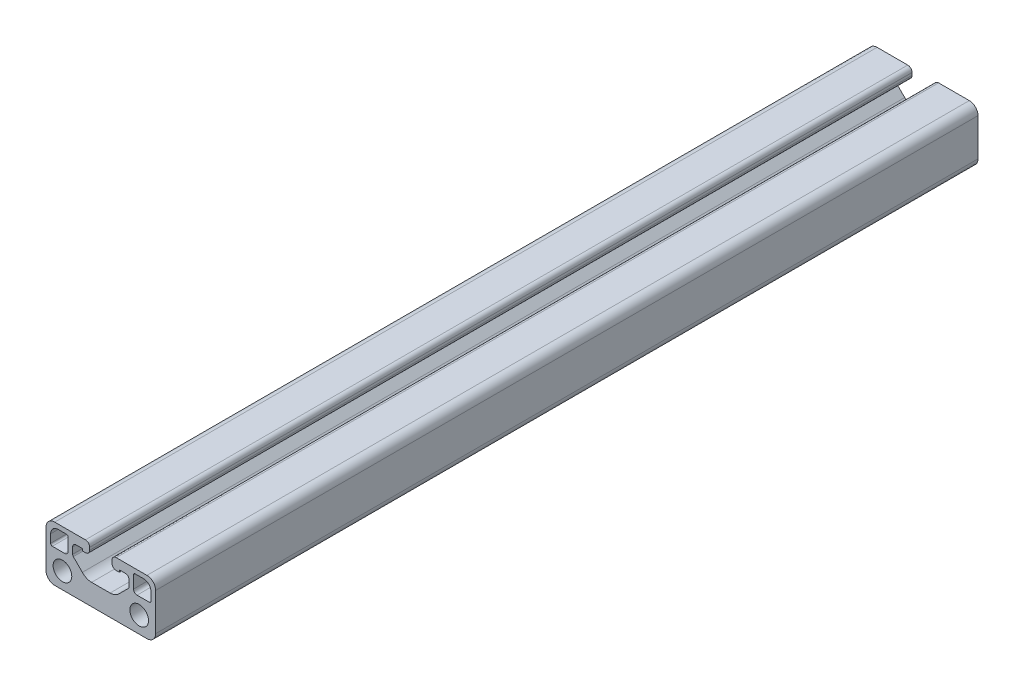
from build123d import *

# Parameters (mm, degrees)
SKETCH1_R      = 3.4036
EXTRUDE1_DEPTH = 300


with BuildPart() as part:
    # Sketch1 → Extrude1 (new body)
    with BuildSketch(Plane.XY):
        with BuildLine():
            Line((-20, 6.825), (-20, -6.825))
            ThreePointArc((-20, -6.825), (-19.07006403, -9.07006403), (-16.825, -10))
            Line((-16.825, -10), (16.825, -10))
            ThreePointArc((16.825, -10), (19.07006403, -9.07006403), (20, -6.825))
            Line((20, -6.825), (20, 6.825))
            ThreePointArc((20, 6.825), (19.07006403, 9.07006403), (16.825, 10))
            Line((16.825, 10), (13.01772333, 10))
            Line((13.01772333, 10), (5.624351215, 10))
            ThreePointArc((5.624351215, 10), (4.518187863, 9.541812137), (4.06, 8.435648785))
            Line((4.06, 8.435648785), (4.06, 7.5148))
            ThreePointArc((4.06, 7.5148), (4.521248241, 6.401248241), (5.6348, 5.94))
            Line((5.6348, 5.94), (6.771827505, 5.94))
            Line((6.771827505, 5.94), (6.771827505, 6.708913257))
            Line((6.771827505, 6.708913257), (9.01577365, 6.708913257))
            ThreePointArc((9.01577365, 6.708913257), (9.929335196, 6.321129388), (10.285, 5.394590897))
            Line((10.285, 5.394590897), (10.285, 3.096216247))
            ThreePointArc((10.285, 3.096216247), (10.241244142, 2.808525014), (10.106931233, 2.550376096))
            Line((10.106931233, 2.550376096), (6.737817619, -0.818737518))
            ThreePointArc((6.737817619, -0.818737518), (5.207385794, -1.896930484), (3.37920183, -2.3))
            Line((3.37920183, -2.3), (-3.37920183, -2.3))
            ThreePointArc((-3.37920183, -2.3), (-5.207385794, -1.896930484), (-6.737817619, -0.818737518))
            Line((-6.737817619, -0.818737518), (-10.024617928, 2.468062791))
            ThreePointArc((-10.024617928, 2.468062791), (-10.217328904, 2.756475149), (-10.285, 3.09668072))
            Line((-10.285, 3.09668072), (-10.285, 5.394590897))
            ThreePointArc((-10.285, 5.394590897), (-9.929335196, 6.321129388), (-9.01577365, 6.708913257))
            Line((-9.01577365, 6.708913257), (-6.771827505, 6.708913257))
            Line((-6.771827505, 6.708913257), (-6.771827505, 5.94))
            Line((-6.771827505, 5.94), (-5.6348, 5.94))
            ThreePointArc((-5.6348, 5.94), (-4.521248241, 6.401248241), (-4.06, 7.5148))
            Line((-4.06, 7.5148), (-4.06, 8.435648785))
            ThreePointArc((-4.06, 8.435648785), (-4.518187863, 9.541812137), (-5.624351215, 10))
            Line((-5.624351215, 10), (-13.017278808, 10))
            Line((-13.017278808, 10), (-16.825, 10))
            ThreePointArc((-16.825, 10), (-19.07006403, 9.07006403), (-20, 6.825))
        make_face()
        with Locations((-14, -4)):
            Circle(SKETCH1_R, mode=Mode.SUBTRACT)
        with Locations((14, -4)):
            Circle(SKETCH1_R, mode=Mode.SUBTRACT)
        with BuildLine():
            Line((-13.212346722, 1.939194793), (-17.688897149, 1.939194793))
            ThreePointArc((-17.688897149, 1.939194793), (-18.133514414, 2.127552649), (-18.31710748, 2.574158493))
            Line((-18.31710748, 2.574158493), (-18.31710748, 5.56561917))
            ThreePointArc((-18.31710748, 5.56561917), (-17.477686114, 7.532412526), (-15.493392654, 8.329584904))
            Line((-15.493392654, 8.329584904), (-12.501931977, 8.329584904))
            ThreePointArc((-12.501931977, 8.329584904), (-12.097931082, 8.115619133), (-11.942346722, 7.68574522))
            Line((-11.942346722, 7.68574522), (-11.942346722, 3.209194793))
            ThreePointArc((-11.942346722, 3.209194793), (-12.31432111, 2.31116918), (-13.212346722, 1.939194793))
        make_face(mode=Mode.SUBTRACT)
        with BuildLine():
            Line((18.32404339, 5.503747464), (18.32404339, 2.512286787))
            ThreePointArc((18.32404339, 2.512286787), (18.11465108, 2.106331374), (17.686957075, 1.945948162))
            Line((17.686957075, 1.945948162), (13.210406647, 1.945948162))
            ThreePointArc((13.210406647, 1.945948162), (12.312381035, 2.31792255), (11.940406647, 3.215948162))
            Line((11.940406647, 3.215948162), (11.940406647, 7.692498589))
            ThreePointArc((11.940406647, 7.692498589), (12.123999713, 8.139104433), (12.568616978, 8.327462289))
            Line((12.568616978, 8.327462289), (15.560077655, 8.327462289))
            ThreePointArc((15.560077655, 8.327462289), (17.526871011, 7.488040923), (18.32404339, 5.503747464))
        make_face(mode=Mode.SUBTRACT)
    extrude(amount=-EXTRUDE1_DEPTH)


solid = part.part
